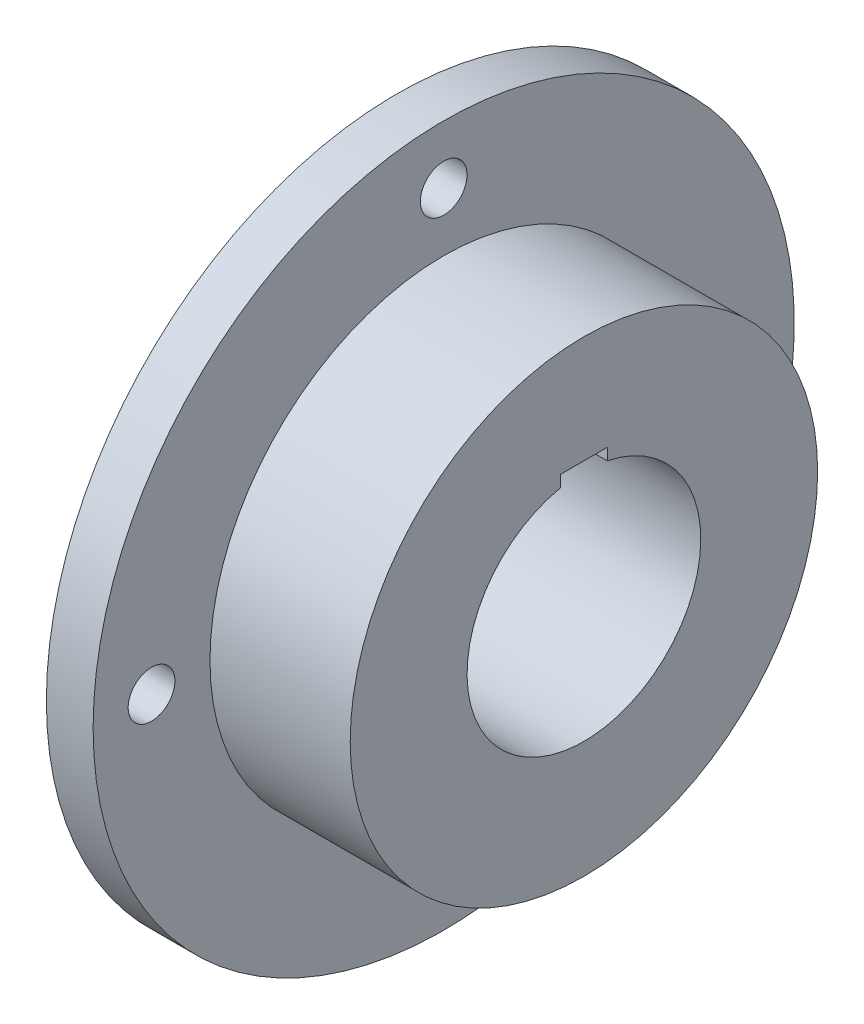
from build123d import *
from build123d.topology import SkipClean

# Parameters (mm, degrees)
SKETCH1_R           = 20
SKETCH1_R_2         = 10
BOSS_EXTRUDE1_DEPTH = 7
SKETCH2_R           = 30
SKETCH2_R_2         = 10
BOSS_EXTRUDE2_DEPTH = 2
SKETCH3_R           = 2
CUT_EXTRUDE1_DEPTH  = 45.09081537
CUT_EXTRUDE2_DEPTH  = 46.343136195


with BuildPart() as part:
    # Sketch1 → Boss-Extrude1 (new, symmetric)
    with BuildSketch(Plane(origin=(0, 0, 0), x_dir=(0, 0, -1), z_dir=(1, 0, 0))):
        Circle(SKETCH1_R)
        Circle(SKETCH1_R_2, mode=Mode.SUBTRACT)
    extrude(amount=BOSS_EXTRUDE1_DEPTH, both=True)

    # Sketch2 → Boss-Extrude2 (add, symmetric)
    with BuildSketch(Plane.ZY.offset(7)):
        Circle(SKETCH2_R)
        Circle(SKETCH2_R_2, mode=Mode.SUBTRACT)
    extrude(amount=BOSS_EXTRUDE2_DEPTH, both=True)

    # Sketch3 → Cut-Extrude1 (cut, through all)
    with BuildSketch(Plane(origin=(-5, 0, 0), x_dir=(0, 0, -1), z_dir=(1, 0, 0))):
        with Locations((0, 25)):
            Circle(SKETCH3_R)
        with Locations((25, 0)):
            Circle(SKETCH3_R)
        with Locations((0, -25)):
            Circle(SKETCH3_R)
        with Locations((-25, 0)):
            Circle(SKETCH3_R)
    extrude(amount=-CUT_EXTRUDE1_DEPTH, mode=Mode.SUBTRACT)

    # Sketch4 → Cut-Extrude2 (cut, through all)
    with SkipClean():  # the faces are left unmerged after this step: merging them gives an invalid solid
        with BuildSketch(Plane(origin=(7, 0, 0), x_dir=(0, 0, -1), z_dir=(1, 0, 0))):
            with BuildLine():
                ThreePointArc((-2, 9.797958971), (-1.00508962, 9.94936153), (0, 10))
                Line((0, 10), (0, 10.797958971))
                Line((0, 10.797958971), (-2, 10.797958971))
                Line((-2, 10.797958971), (-2, 9.797958971))
            make_face()
            with BuildLine():
                Line((0, 10.797958971), (0, 10))
                ThreePointArc((0, 10), (1.00508962, 9.94936153), (2, 9.797958971))
                Line((2, 9.797958971), (2, 10.797958971))
                Line((2, 10.797958971), (0, 10.797958971))
            make_face()
        extrude(amount=-CUT_EXTRUDE2_DEPTH, mode=Mode.SUBTRACT)


solid = part.part
